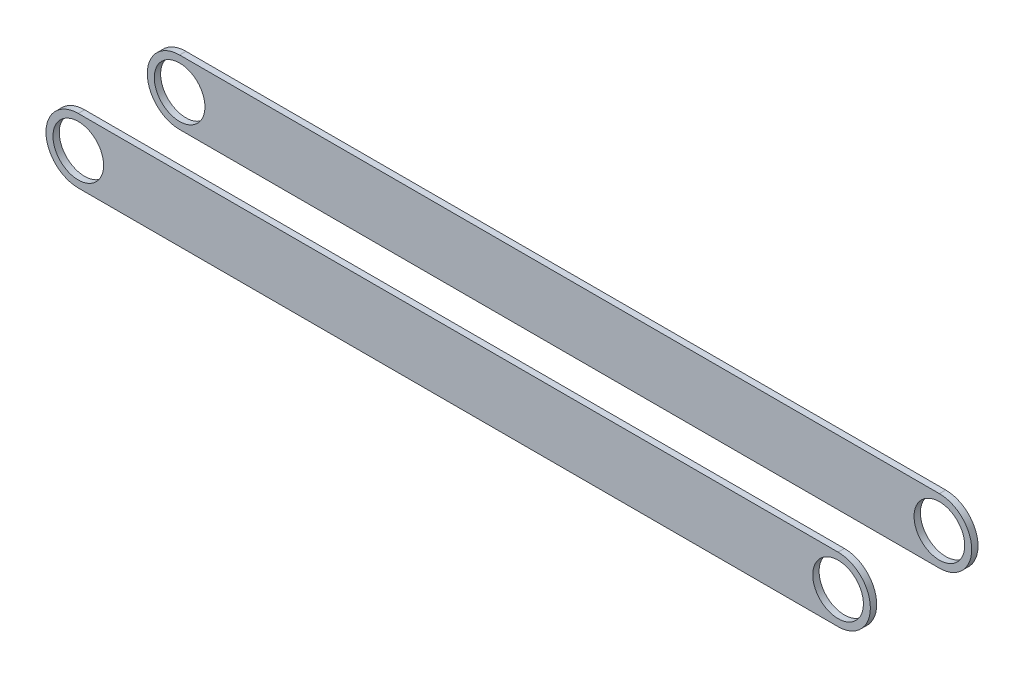
from build123d import *

# Parameters (mm, degrees)
SKETCH1_R           = 40
BOSS_EXTRUDE1_DEPTH = 10


with BuildPart() as part:
    # Sketch1 → Boss-Extrude1 (new body)
    with BuildSketch(Plane.XY):
        with BuildLine():
            Line((0, -51), (-1200, -51))
            ThreePointArc((-1200, -51), (-1251, 0), (-1200, 51))
            Line((-1200, 51), (0, 51))
            ThreePointArc((0, 51), (51, 0), (0, -51))
        make_face()
        Circle(SKETCH1_R, mode=Mode.SUBTRACT)
        with Locations((-1200, 0)):
            Circle(SKETCH1_R, mode=Mode.SUBTRACT)
    extrude(amount=BOSS_EXTRUDE1_DEPTH)


with BuildPart() as body_2:
    # 镜向4: mirrored copy
    add(part.part.mirror(Plane.XY.offset(85)))


solid = Compound([part.part, body_2.part])
